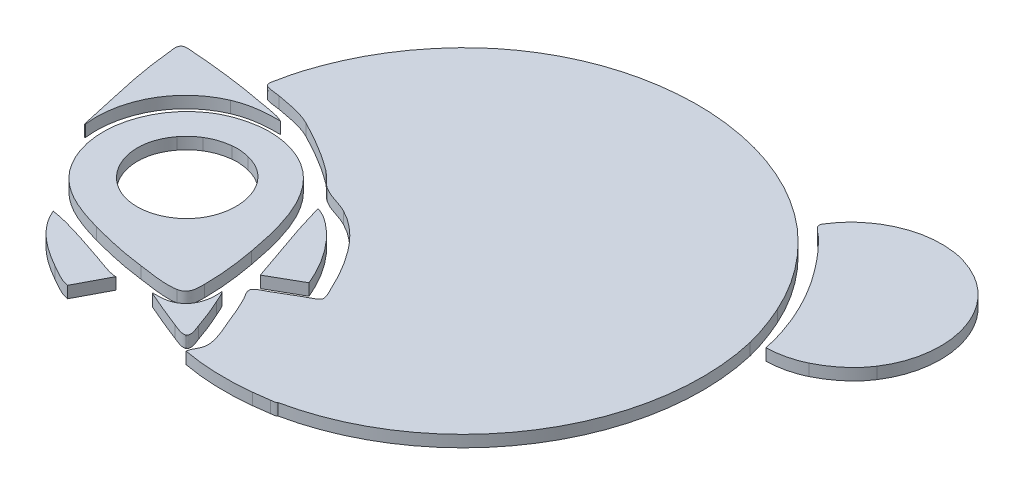
from build123d import *

# Parameters (mm, degrees)
SALIENTE_EXTRUIR1_DEPTH    = 0.3
SALIENTE_EXTRUIR1_2_DEPTH  = 0.3
SALIENTE_EXTRUIR1_3_DEPTH  = 0.3
SALIENTE_EXTRUIR1_4_DEPTH  = 0.3
SALIENTE_EXTRUIR1_5_DEPTH  = 0.3
SALIENTE_EXTRUIR1_6_DEPTH  = 0.3
SALIENTE_EXTRUIR1_7_DEPTH  = 0.3
SALIENTE_EXTRUIR1_8_DEPTH  = 0.3
SALIENTE_EXTRUIR1_9_DEPTH  = 0.3
SALIENTE_EXTRUIR1_10_DEPTH = 0.3
SALIENTE_EXTRUIR1_11_DEPTH = 0.3
SALIENTE_EXTRUIR1_12_DEPTH = 0.3
SALIENTE_EXTRUIR1_13_DEPTH = 0.3
SALIENTE_EXTRUIR1_14_DEPTH = 0.3
SALIENTE_EXTRUIR1_15_DEPTH = 0.3
SALIENTE_EXTRUIR1_16_DEPTH = 0.3
SALIENTE_EXTRUIR1_17_DEPTH = 0.3
SALIENTE_EXTRUIR1_18_DEPTH = 0.3
CROQUIS3_W                 = 32.379620454
CROQUIS3_H                 = 8.703750059
CORTAR_EXTRUIR2_DEPTH      = 10
SALIENTE_EXTRUIR2_DEPTH    = 0.3


with BuildPart() as part:
    # Croquis1 → Saliente-Extruir1 (new body)
    with BuildSketch(Plane(origin=(0, 0, 0), x_dir=(1, 0, 0), z_dir=(0, 1, 0))):
        with BuildLine():
            Line((3.578406282, 3.929124777), (1.831381085, 3.929124777))
            add(Edge.make_bspline(
                [(1.831381085, 3.929124777), (2.195955538, 4.293699449), (2.561850832, 4.656953063), (2.925104228, 5.022805122)],
                knots=[0, 0, 0, 0, 1, 1, 1, 1], degree=3))
            add(Edge.make_bspline(
                [(2.925104228, 5.022805122), (3.050477873, 5.149089533), (3.225876383, 5.406839742), (3.393761239, 5.468737315)],
                knots=[0, 0, 0, 0, 1, 1, 1, 1], degree=3))
            add(Edge.make_bspline(
                [(3.393761239, 5.468737315), (3.539659104, 5.52252512), (3.778106582, 5.477296898), (3.933492482, 5.477296898)],
                knots=[0, 0, 0, 0, 1, 1, 1, 1], degree=3))
            Line((3.933492482, 5.477296898), (5.154989666, 5.477296898))
            Line((5.154989666, 5.477296898), (5.154989666, 2.480368276))
            Line((5.154989666, 2.480368276), (5.169193769, 2.480368276))
            add(Edge.make_bspline(
                [(5.169193769, 2.480368276), (5.184873963, 2.677469913), (5.263674964, 2.886373947), (5.350372835, 3.062709863)],
                knots=[0, 0, 0, 0, 1, 1, 1, 1], degree=3))
            add(Edge.make_bspline(
                [(5.350372835, 3.062709863), (5.429102652, 3.222826461), (5.527291326, 3.374887662), (5.652324117, 3.503017188)],
                knots=[0, 0, 0, 0, 1, 1, 1, 1], degree=3))
            add(Edge.make_bspline(
                [(5.652324117, 3.503017188), (6.163520725, 4.026898354), (6.976569044, 4.092033938), (7.66900171, 4.026131922)],
                knots=[0, 0, 0, 0, 1, 1, 1, 1], degree=3))
            add(Edge.make_bspline(
                [(7.66900171, 4.026131922), (7.927561368, 4.001529673), (8.175738383, 3.943324513), (8.435988121, 3.943324513)],
                knots=[0, 0, 0, 0, 1, 1, 1, 1], degree=3))
            add(Edge.make_bspline(
                [(8.435988121, 3.943324513), (8.421102745, 4.664846657), (8.194841973, 5.406920534), (7.900603268, 6.059638484)],
                knots=[0, 0, 0, 0, 1, 1, 1, 1], degree=3))
            add(Edge.make_bspline(
                [(7.900603268, 6.059638484), (7.603907177, 6.717756614), (7.184706429, 7.310922142), (6.674759913, 7.820867784)],
                knots=[0, 0, 0, 0, 1, 1, 1, 1], degree=3))
            add(Edge.make_bspline(
                [(6.674759913, 7.820867784), (4.340535784, 10.155095188), (0.329636401, 10.188178411), (-1.988793551, 7.792404989)],
                knots=[0, 0, 0, 0, 1, 1, 1, 1], degree=3))
            add(Edge.make_bspline(
                [(-1.988793551, 7.792404989), (-2.582355833, 7.179041248), (-3.048016117, 6.446839277), (-3.346856689, 5.647739365)],
                knots=[0, 0, 0, 0, 1, 1, 1, 1], degree=3))
            add(Edge.make_bspline(
                [(-3.346856689, 5.647739365), (-3.449590458, 5.373001005), (-3.543901117, 5.085311909), (-3.59318728, 4.79553314)],
                knots=[0, 0, 0, 0, 1, 1, 1, 1], degree=3))
            add(Edge.make_bspline(
                [(-3.59318728, 4.79553314), (-3.604421732, 4.72948679), (-3.66630664, 4.565535848), (-3.622290079, 4.507599266)],
                knots=[0, 0, 0, 0, 1, 1, 1, 1], degree=3))
            add(Edge.make_bspline(
                [(-3.622290079, 4.507599266), (-3.566200576, 4.433755617), (-3.326460645, 4.433897549), (-3.239251383, 4.417564468)],
                knots=[0, 0, 0, 0, 1, 1, 1, 1], degree=3))
            add(Edge.make_bspline(
                [(-3.239251383, 4.417564468), (-2.921363774, 4.357994578), (-2.57941566, 4.304986306), (-2.28761993, 4.159089096)],
                knots=[0, 0, 0, 0, 1, 1, 1, 1], degree=3))
            add(Edge.make_bspline(
                [(-2.28761993, 4.159089096), (-1.838094895, 3.934334767), (-1.38344219, 3.663913319), (-0.980902058, 3.362474084)],
                knots=[0, 0, 0, 0, 1, 1, 1, 1], degree=3))
            add(Edge.make_bspline(
                [(-0.980902058, 3.362474084), (-0.821809334, 3.243336705), (-0.708252716, 3.076018703), (-0.540594951, 2.969478104)],
                knots=[0, 0, 0, 0, 1, 1, 1, 1], degree=3))
            add(Edge.make_bspline(
                [(-0.540594951, 2.969478104), (-0.333579702, 2.837927147), (-0.07820172, 2.799577161), (0.141170772, 2.689898776)],
                knots=[0, 0, 0, 0, 1, 1, 1, 1], degree=3))
            add(Edge.make_bspline(
                [(0.141170772, 2.689898776), (0.511298691, 2.504826409), (0.835989639, 2.197777591), (1.084322779, 1.869620448)],
                knots=[0, 0, 0, 0, 1, 1, 1, 1], degree=3))
            add(Edge.make_bspline(
                [(1.084322779, 1.869620448), (1.33001424, 1.544943912), (1.540693951, 1.189459429), (1.707897098, 0.81856333)],
                knots=[0, 0, 0, 0, 1, 1, 1, 1], degree=3))
            add(Edge.make_bspline(
                [(1.707897098, 0.81856333), (1.743135938, 0.740374165), (1.885795355, 0.518871167), (1.824251739, 0.44045491)],
                knots=[0, 0, 0, 0, 1, 1, 1, 1], degree=3))
            add(Edge.make_bspline(
                [(1.824251739, 0.44045491), (1.764753469, 0.3646502), (1.629991141, 0.314227271), (1.54731278, 0.266761111)],
                knots=[0, 0, 0, 0, 1, 1, 1, 1], degree=3))
            add(Edge.make_bspline(
                [(1.54731278, 0.266761111), (1.356759223, 0.157364406), (1.168165855, 0.044375734), (0.979174641, -0.06768929)],
                knots=[0, 0, 0, 0, 1, 1, 1, 1], degree=3))
            add(Edge.make_bspline(
                [(0.979174641, -0.06768929), (0.905629267, -0.111292938), (0.712476174, -0.17778015), (0.702647503, -0.275315719)],
                knots=[0, 0, 0, 0, 1, 1, 1, 1], degree=3))
            add(Edge.make_bspline(
                [(0.702647503, -0.275315719), (0.693756018, -0.363531824), (0.792825324, -0.48487264), (0.832751191, -0.559170471)],
                knots=[0, 0, 0, 0, 1, 1, 1, 1], degree=3))
            add(Edge.make_bspline(
                [(0.832751191, -0.559170471), (0.941933251, -0.762395048), (1.029199287, -0.984238683), (1.114831795, -1.198326505)],
                knots=[0, 0, 0, 0, 1, 1, 1, 1], degree=3))
            add(Edge.make_bspline(
                [(1.114831795, -1.198326505), (1.212949285, -1.443619465), (1.394554802, -1.782002251), (1.387396196, -2.050532731)],
                knots=[0, 0, 0, 0, 1, 1, 1, 1], degree=3))
            add(Edge.make_bspline(
                [(1.387396196, -2.050532731), (1.383277989, -2.204755882), (1.259564946, -2.307446852), (1.249039498, -2.448225563)],
                knots=[0, 0, 0, 0, 1, 1, 1, 1], degree=3))
            add(Edge.make_bspline(
                [(1.249039498, -2.448225563), (1.825884173, -2.555320788), (2.428281167, -2.569708311), (3.010267706, -2.507398044)],
                knots=[0, 0, 0, 0, 1, 1, 1, 1], degree=3))
            add(Edge.make_bspline(
                [(3.010267706, -2.507398044), (3.148538372, -2.49259346), (3.284877454, -2.477129439), (3.422167917, -2.454105909)],
                knots=[0, 0, 0, 0, 1, 1, 1, 1], degree=3))
            add(Edge.make_bspline(
                [(3.422167917, -2.454105909), (3.463372044, -2.447184002), (3.535980231, -2.44794825), (3.563804769, -2.411454295)],
                knots=[0, 0, 0, 0, 1, 1, 1, 1], degree=3))
            add(Edge.make_bspline(
                [(3.563804769, -2.411454295), (3.6257744, -2.330182151), (3.578406282, -2.066466219), (3.578406282, -1.965308331)],
                knots=[0, 0, 0, 0, 1, 1, 1, 1], degree=3))
            add(Edge.make_bspline(
                [(3.578406282, -1.965308331), (3.578406282, -1.558223977), (3.582638034, -1.150556611), (3.578463054, -0.74381071)],
                knots=[0, 0, 0, 0, 1, 1, 1, 1], degree=3))
            add(Edge.make_bspline(
                [(3.578463054, -0.74381071), (3.562442224, 0.813455967), (3.578406282, 2.371759839), (3.578406282, 3.929124777)],
                knots=[0, 0, 0, 0, 1, 1, 1, 1], degree=3))
        make_face()
    extrude(amount=SALIENTE_EXTRUIR1_DEPTH)


with BuildPart() as body_2:
    # Croquis1 → Saliente-Extruir1 2 (new body)
    with BuildSketch(Plane(origin=(0, 0, 0), x_dir=(1, 0, 0), z_dir=(0, 1, 0))):
        with BuildLine():
            Line((3.038675476, 4.426241963), (4.075527835, 4.426241963))
            Line((4.075527835, 4.426241963), (4.075527835, -0.829037512))
            Line((4.075527835, -0.829037512), (4.075527835, -2.078940937))
            add(Edge.make_bspline(
                [(4.075527835, -2.078940937), (4.075527835, -2.159346423), (4.032391907, -2.438244478), (4.098295888, -2.490442647)],
                knots=[0, 0, 0, 0, 1, 1, 1, 1], degree=3))
            add(Edge.make_bspline(
                [(4.098295888, -2.490442647), (4.135480505, -2.519901148), (4.215829437, -2.50505071), (4.260172659, -2.50505071)],
                knots=[0, 0, 0, 0, 1, 1, 1, 1], degree=3))
            Line((4.260172659, -2.50505071), (4.657869422, -2.50505071))
            Line((4.657869422, -2.50505071), (4.657869422, 4.980170977))
            Line((4.657869422, 4.980170977), (3.919289689, 4.980170977))
            Line((3.919289689, 4.980170977), (3.592610385, 4.971611394))
            Line((3.592610385, 4.971611394), (3.407965342, 4.809735059))
            Line((3.407965342, 4.809735059), (3.038675476, 4.426241963))
        make_face()
    extrude(amount=SALIENTE_EXTRUIR1_2_DEPTH)


with BuildPart() as body_3:
    # Croquis1 → Saliente-Extruir1 3 (new body)
    with BuildSketch(Plane(origin=(0, 0, 0), x_dir=(1, 0, 0), z_dir=(0, 1, 0))):
        with BuildLine():
            Line((18.63406794, 4.809735059), (18.63406794, 0.733343079))
            add(Edge.make_bspline(
                [(18.63406794, 0.733343079), (18.63406794, 0.008298841), (18.545581291, -0.783842043), (18.690882169, -1.49659935)],
                knots=[0, 0, 0, 0, 1, 1, 1, 1], degree=3))
            add(Edge.make_bspline(
                [(18.690882169, -1.49659935), (18.793005412, -1.996943849), (19.118832688, -2.395706629), (19.642512967, -2.474734066)],
                knots=[0, 0, 0, 0, 1, 1, 1, 1], degree=3))
            add(Edge.make_bspline(
                [(19.642512967, -2.474734066), (19.723756943, -2.486983876), (20.010524574, -2.555111166), (20.068190393, -2.482267372)],
                knots=[0, 0, 0, 0, 1, 1, 1, 1], degree=3))
            add(Edge.make_bspline(
                [(20.068190393, -2.482267372), (20.095744825, -2.44748315), (20.082820292, -2.375925696), (20.082820292, -2.33459514)],
                knots=[0, 0, 0, 0, 1, 1, 1, 1], degree=3))
            Line((20.082820292, -2.33459514), (20.082820292, -1.936897941))
            add(Edge.make_bspline(
                [(20.082820292, -1.936897941), (19.934820307, -1.936897941), (19.784263365, -1.944016369), (19.642512967, -1.893008245)],
                knots=[0, 0, 0, 0, 1, 1, 1, 1], degree=3))
            add(Edge.make_bspline(
                [(19.642512967, -1.893008245), (19.174367347, -1.724498016), (19.216409745, -1.115468873), (19.216409745, -0.71540032)],
                knots=[0, 0, 0, 0, 1, 1, 1, 1], degree=3))
            Line((19.216409745, -0.71540032), (19.216409745, 2.878074209))
            Line((19.216409745, 2.878074209), (20.082820292, 2.878074209))
            Line((20.082820292, 2.878074209), (20.082820292, 3.275771409))
            Line((20.082820292, 3.275771409), (20.068190393, 3.42344364))
            Line((20.068190393, 3.42344364), (19.855565561, 3.446211693))
            Line((19.855565561, 3.446211693), (19.216409745, 3.446211693))
            Line((19.216409745, 3.446211693), (19.216409745, 4.809743794))
            Line((19.216409745, 4.809743794), (18.63406794, 4.809735059))
        make_face()
    extrude(amount=SALIENTE_EXTRUIR1_3_DEPTH)


with BuildPart() as body_4:
    # Croquis1 → Saliente-Extruir1 4 (new body)
    with BuildSketch(Plane(origin=(0, 0, 0), x_dir=(1, 0, 0), z_dir=(0, 1, 0))):
        with BuildLine():
            Line((23.889347415, 4.809743794), (23.889347415, 0.804370145))
            add(Edge.make_bspline(
                [(23.889347415, 0.804370145), (23.889347415, 0.086455253), (23.82088604, -0.67162417), (23.921871645, -1.382962158)],
                knots=[0, 0, 0, 0, 1, 1, 1, 1], degree=3))
            add(Edge.make_bspline(
                [(23.921871645, -1.382962158), (23.977408269, -1.775148035), (24.15892819, -2.172987166), (24.528501047, -2.357745317)],
                knots=[0, 0, 0, 0, 1, 1, 1, 1], degree=3))
            add(Edge.make_bspline(
                [(24.528501047, -2.357745317), (24.773512327, -2.480265041), (25.054172739, -2.505035425), (25.323895446, -2.505035425)],
                knots=[0, 0, 0, 0, 1, 1, 1, 1], degree=3))
            Line((25.323895446, -2.505035425), (25.323895446, -1.936897941))
            add(Edge.make_bspline(
                [(25.323895446, -1.936897941), (25.180439464, -1.936897941), (25.035138586, -1.942444201), (24.897792224, -1.893008245)],
                knots=[0, 0, 0, 0, 1, 1, 1, 1], degree=3))
            add(Edge.make_bspline(
                [(24.897792224, -1.893008245), (24.430356263, -1.724753493), (24.471689002, -1.129629305), (24.471689002, -0.729604423)],
                knots=[0, 0, 0, 0, 1, 1, 1, 1], degree=3))
            Line((24.471689002, -0.729604423), (24.471689002, 2.878074209))
            Line((24.471689002, 2.878074209), (25.323895446, 2.878074209))
            Line((25.323895446, 2.878074209), (25.323895446, 3.446211693))
            Line((25.323895446, 3.446211693), (24.471689002, 3.446211693))
            Line((24.471689002, 3.446211693), (24.471689002, 4.809743794))
            Line((24.471689002, 4.809743794), (23.889347415, 4.809743794))
        make_face()
    extrude(amount=SALIENTE_EXTRUIR1_4_DEPTH)


with BuildPart() as body_5:
    # Croquis1 → Saliente-Extruir1 5 (new body)
    with BuildSketch(Plane(origin=(0, 0, 0), x_dir=(1, 0, 0), z_dir=(0, 1, 0))):
        with BuildLine():
            Line((-5.099902854, 1.301487332), (-5.085700498, 1.301487332))
            add(Edge.make_bspline(
                [(-5.085700498, 1.301487332), (-5.211824417, 2.29946412), (-4.694224936, 3.292242054), (-3.750575948, 3.695806498)],
                knots=[0, 0, 0, 0, 1, 1, 1, 1], degree=3))
            add(Edge.make_bspline(
                [(-3.750575948, 3.695806498), (-3.393032361, 3.848706189), (-3.039678822, 3.872312731), (-2.656910015, 3.872312731)],
                knots=[0, 0, 0, 0, 1, 1, 1, 1], degree=3))
            add(Edge.make_bspline(
                [(-2.656910015, 3.872312731), (-2.840816138, 3.970813437), (-3.106577199, 3.987814689), (-3.310268841, 4.028549131)],
                knots=[0, 0, 0, 0, 1, 1, 1, 1], degree=3))
            add(Edge.make_bspline(
                [(-3.310268841, 4.028549131), (-3.835541159, 4.133585034), (-4.368431941, 4.201845521), (-4.901055892, 4.253390803)],
                knots=[0, 0, 0, 0, 1, 1, 1, 1], degree=3))
            add(Edge.make_bspline(
                [(-4.901055892, 4.253390803), (-5.071193097, 4.269854897), (-5.242778007, 4.274418552), (-5.412380238, 4.29436762)],
                knots=[0, 0, 0, 0, 1, 1, 1, 1], degree=3))
            add(Edge.make_bspline(
                [(-5.412380238, 4.29436762), (-5.478458687, 4.302141119), (-5.569636801, 4.304346521), (-5.608685965, 4.238562199)],
                knots=[0, 0, 0, 0, 1, 1, 1, 1], degree=3))
            add(Edge.make_bspline(
                [(-5.608685965, 4.238562199), (-5.647504108, 4.173168736), (-5.621132297, 4.070648302), (-5.613583706, 4.000143108)],
                knots=[0, 0, 0, 0, 1, 1, 1, 1], degree=3))
            add(Edge.make_bspline(
                [(-5.613583706, 4.000143108), (-5.593783121, 3.815199354), (-5.573445815, 3.630312591), (-5.546194026, 3.446207326)],
                knots=[0, 0, 0, 0, 1, 1, 1, 1], degree=3))
            add(Edge.make_bspline(
                [(-5.546194026, 3.446207326), (-5.438327346, 2.717470676), (-5.248563586, 2.019812734), (-5.099902854, 1.301487332)],
                knots=[0, 0, 0, 0, 1, 1, 1, 1], degree=3))
        make_face()
    extrude(amount=SALIENTE_EXTRUIR1_5_DEPTH)


with BuildPart() as body_6:
    # Croquis1 → Saliente-Extruir1 6 (new body)
    with BuildSketch(Plane(origin=(0, 0, 0), x_dir=(1, 0, 0), z_dir=(0, 1, 0))):
        with BuildLine():
            Line((5.595298301, -2.505039792), (6.16343644, -2.505039792))
            add(Edge.make_bspline(
                [(6.16343644, -2.505039792), (6.16343644, -1.089766107), (6.146662278, 0.326632115), (6.163493212, 1.741792473)],
                knots=[0, 0, 0, 0, 1, 1, 1, 1], degree=3))
            add(Edge.make_bspline(
                [(6.163493212, 1.741792473), (6.16898925, 2.204612155), (6.291054574, 2.919302137), (6.873609058, 2.962012489)],
                knots=[0, 0, 0, 0, 1, 1, 1, 1], degree=3))
            add(Edge.make_bspline(
                [(6.873609058, 2.962012489), (7.500237313, 3.007946003), (7.726938511, 2.380834743), (7.739806707, 1.855420712)],
                knots=[0, 0, 0, 0, 1, 1, 1, 1], degree=3))
            add(Edge.make_bspline(
                [(7.739806707, 1.855420712), (7.775372209, 0.403899816), (7.740019824, -1.053034143), (7.740019824, -2.505039792)],
                knots=[0, 0, 0, 0, 1, 1, 1, 1], degree=3))
            Line((7.740019824, -2.505039792), (8.308157962, -2.505039792))
            Line((8.308157962, -2.505039792), (8.308157962, 1.585556074))
            add(Edge.make_bspline(
                [(8.308157962, 1.585556074), (8.308157962, 2.198775481), (8.285290557, 2.929117271), (7.725816376, 3.317822541)],
                knots=[0, 0, 0, 0, 1, 1, 1, 1], degree=3))
            add(Edge.make_bspline(
                [(7.725816376, 3.317822541), (6.987364599, 3.830866447), (5.919236355, 3.435754591), (5.693074717, 2.579796779)],
                knots=[0, 0, 0, 0, 1, 1, 1, 1], degree=3))
            add(Edge.make_bspline(
                [(5.693074717, 2.579796779), (5.531340096, 1.967656054), (5.595298301, 1.304312867), (5.595298301, 0.676533217)],
                knots=[0, 0, 0, 0, 1, 1, 1, 1], degree=3))
            Line((5.595298301, 0.676533217), (5.595298301, -2.505039792))
        make_face()
    extrude(amount=SALIENTE_EXTRUIR1_6_DEPTH)


with BuildPart() as body_7:
    # Croquis1 → Saliente-Extruir1 7 (new body)
    with BuildSketch(Plane(origin=(0, 0, 0), x_dir=(1, 0, 0), z_dir=(0, 1, 0))):
        with BuildLine():
            Line((12.824857486, 0.026684474), (13.946930752, 0.587804192))
            add(Edge.make_bspline(
                [(13.946930752, 0.587804192), (14.084702691, 0.656719531), (14.333548533, 0.726146042), (14.435529626, 0.841820502)],
                knots=[0, 0, 0, 0, 1, 1, 1, 1], degree=3))
            add(Edge.make_bspline(
                [(14.435529626, 0.841820502), (14.511517756, 0.92800589), (14.458254007, 1.23161974), (14.458254007, 1.344097457)],
                knots=[0, 0, 0, 0, 1, 1, 1, 1], degree=3))
            add(Edge.make_bspline(
                [(14.458254007, 1.344097457), (14.458254007, 1.85390095), (14.475875392, 2.394938402), (14.24136707, 2.863865739)],
                knots=[0, 0, 0, 0, 1, 1, 1, 1], degree=3))
            add(Edge.make_bspline(
                [(14.24136707, 2.863865739), (13.81668535, 3.713218043), (12.481275627, 3.769278941), (11.993244699, 2.949087956)],
                knots=[0, 0, 0, 0, 1, 1, 1, 1], degree=3))
            add(Edge.make_bspline(
                [(11.993244699, 2.949087956), (11.716845518, 2.484464647), (11.731191116, 1.922006403), (11.731191116, 1.400909503)],
                knots=[0, 0, 0, 0, 1, 1, 1, 1], degree=3))
            Line((11.731191116, 1.400909503), (11.731191116, -0.317707488))
            add(Edge.make_bspline(
                [(11.731191116, -0.317707488), (11.731191116, -0.761381873), (11.713720397, -1.207525873), (11.836722689, -1.638629463)],
                knots=[0, 0, 0, 0, 1, 1, 1, 1], degree=3))
            add(Edge.make_bspline(
                [(11.836722689, -1.638629463), (12.044377286, -2.366612783), (12.738927575, -2.726073541), (13.464013302, -2.549099806)],
                knots=[0, 0, 0, 0, 1, 1, 1, 1], degree=3))
            add(Edge.make_bspline(
                [(13.464013302, -2.549099806), (14.070642704, -2.40101488), (14.362950262, -1.832578029), (14.432121078, -1.255136367)],
                knots=[0, 0, 0, 0, 1, 1, 1, 1], degree=3))
            add(Edge.make_bspline(
                [(14.432121078, -1.255136367), (14.44718769, -1.128341001), (14.458254007, -0.999445043), (14.458254007, -0.871643271)],
                knots=[0, 0, 0, 0, 1, 1, 1, 1], degree=3))
            add(Edge.make_bspline(
                [(14.458254007, -0.871643271), (14.458254007, -0.83447241), (14.468909814, -0.770670767), (14.435529626, -0.744208119)],
                knots=[0, 0, 0, 0, 1, 1, 1, 1], degree=3))
            add(Edge.make_bspline(
                [(14.435529626, -0.744208119), (14.398315312, -0.714751801), (14.317925111, -0.729600056), (14.27360962, -0.729600056)],
                knots=[0, 0, 0, 0, 1, 1, 1, 1], degree=3))
            Line((14.27360962, -0.729600056), (13.87591242, -0.729608791))
            add(Edge.make_bspline(
                [(13.87591242, -0.729608791), (13.87591242, -1.065532881), (13.873641511, -1.416089053), (13.683457196, -1.709645393)],
                knots=[0, 0, 0, 0, 1, 1, 1, 1], degree=3))
            add(Edge.make_bspline(
                [(13.683457196, -1.709645393), (13.441712532, -2.082814585), (12.907804426, -2.152679993), (12.598880141, -1.823217078)],
                knots=[0, 0, 0, 0, 1, 1, 1, 1], degree=3))
            add(Edge.make_bspline(
                [(12.598880141, -1.823217078), (12.443637483, -1.657619727), (12.374322333, -1.432210328), (12.338387372, -1.212526241)],
                knots=[0, 0, 0, 0, 1, 1, 1, 1], degree=3))
            add(Edge.make_bspline(
                [(12.338387372, -1.212526241), (12.300181501, -0.978480617), (12.313531829, -0.738755753), (12.313531829, -0.502351876)],
                knots=[0, 0, 0, 0, 1, 1, 1, 1], degree=3))
            add(Edge.make_bspline(
                [(12.313531829, -0.502351876), (12.313531829, -0.431023696), (12.288534355, -0.300110122), (12.328161728, -0.238026946)],
                knots=[0, 0, 0, 0, 1, 1, 1, 1], degree=3))
            add(Edge.make_bspline(
                [(12.328161728, -0.238026946), (12.403724063, -0.119511666), (12.699725998, -0.03591184), (12.824857486, 0.026684474)],
                knots=[0, 0, 0, 0, 1, 1, 1, 1], degree=3))
        make_face()
        with BuildLine():
            add(Edge.make_bspline(
                [(12.313529646, 0.435074601), (12.313529646, 0.940078832), (12.291934168, 1.450367076), (12.314184716, 1.954845067)],
                knots=[0, 0, 0, 0, 1, 1, 1, 1], degree=3))
            add(Edge.make_bspline(
                [(12.314184716, 1.954845067), (12.321718022, 2.127801038), (12.3607733, 2.30332685), (12.417871393, 2.466170723)],
                knots=[0, 0, 0, 0, 1, 1, 1, 1], degree=3))
            add(Edge.make_bspline(
                [(12.417871393, 2.466170723), (12.593851387, 2.967637357), (13.24848891, 3.155605352), (13.617780087, 2.736035362)],
                knots=[0, 0, 0, 0, 1, 1, 1, 1], degree=3))
            add(Edge.make_bspline(
                [(13.617780087, 2.736035362), (13.862363387, 2.458102444), (13.875997579, 2.03466754), (13.875997579, 1.684980428)],
                knots=[0, 0, 0, 0, 1, 1, 1, 1], degree=3))
            add(Edge.make_bspline(
                [(13.875997579, 1.684980428), (13.875997579, 1.573354301), (13.925710848, 1.303332446), (13.861367681, 1.211109495)],
                knots=[0, 0, 0, 0, 1, 1, 1, 1], degree=3))
            add(Edge.make_bspline(
                [(13.861367681, 1.211109495), (13.79219883, 1.111984289), (13.557415378, 1.046306962), (13.449894358, 0.992519376)],
                knots=[0, 0, 0, 0, 1, 1, 1, 1], degree=3))
            add(Edge.make_bspline(
                [(13.449894358, 0.992519376), (13.088699847, 0.81192092), (12.701230475, 0.546742216), (12.313529646, 0.435074601)],
                knots=[0, 0, 0, 0, 1, 1, 1, 1], degree=3))
        make_face(mode=Mode.SUBTRACT)
    extrude(amount=SALIENTE_EXTRUIR1_7_DEPTH)


with BuildPart() as body_8:
    # Croquis1 → Saliente-Extruir1 8 (new body)
    with BuildSketch(Plane(origin=(0, 0, 0), x_dir=(1, 0, 0), z_dir=(0, 1, 0))):
        with BuildLine():
            Line((17.298946448, -2.505031057), (17.725049669, -2.505031057))
            add(Edge.make_bspline(
                [(17.725049669, -2.505031057), (17.768227523, -2.505031057), (17.849329567, -2.519748299), (17.872765572, -2.472107235)],
                knots=[0, 0, 0, 0, 1, 1, 1, 1], degree=3))
            add(Edge.make_bspline(
                [(17.872765572, -2.472107235), (17.91906811, -2.377853785), (17.881281484, -2.183507592), (17.881281484, -2.078927836)],
                knots=[0, 0, 0, 0, 1, 1, 1, 1], degree=3))
            Line((17.881281484, -2.078927836), (17.881281484, -1.098889049))
            add(Edge.make_bspline(
                [(17.881281484, -1.098889049), (17.881281484, -0.073244284), (17.912528327, 0.959377196), (17.86763419, 1.983259824)],
                knots=[0, 0, 0, 0, 1, 1, 1, 1], degree=3))
            add(Edge.make_bspline(
                [(17.86763419, 1.983259824), (17.846038931, 2.477158432), (17.716793603, 3.045125598), (17.270520773, 3.331310216)],
                knots=[0, 0, 0, 0, 1, 1, 1, 1], degree=3))
            add(Edge.make_bspline(
                [(17.270520773, 3.331310216), (16.580090438, 3.774089339), (15.593376269, 3.492946577), (15.3023485, 2.721839993)],
                knots=[0, 0, 0, 0, 1, 1, 1, 1], degree=3))
            add(Edge.make_bspline(
                [(15.3023485, 2.721839993), (15.128355552, 2.261109767), (15.154206801, 1.756686583), (15.154206801, 1.27308786)],
                knots=[0, 0, 0, 0, 1, 1, 1, 1], degree=3))
            Line((15.154206801, 1.27308786), (15.154206801, -0.786412101))
            Line((15.154206801, -0.786412101), (15.154206801, -2.064723732))
            add(Edge.make_bspline(
                [(15.154206801, -2.064723732), (15.154206801, -2.147118448), (15.109749378, -2.43716798), (15.176931182, -2.490429545)],
                knots=[0, 0, 0, 0, 1, 1, 1, 1], degree=3))
            add(Edge.make_bspline(
                [(15.176931182, -2.490429545), (15.227353892, -2.530299294), (15.362713208, -2.505037608), (15.42407144, -2.505037608)],
                knots=[0, 0, 0, 0, 1, 1, 1, 1], degree=3))
            add(Edge.make_bspline(
                [(15.42407144, -2.505037608), (15.49366827, -2.505037608), (15.657293641, -2.535205769), (15.713821823, -2.490429545)],
                knots=[0, 0, 0, 0, 1, 1, 1, 1], degree=3))
            add(Edge.make_bspline(
                [(15.713821823, -2.490429545), (15.762541569, -2.451824081), (15.736548388, -2.305302589), (15.736548388, -2.249368338)],
                knots=[0, 0, 0, 0, 1, 1, 1, 1], degree=3))
            Line((15.736548388, -2.249368338), (15.736548388, -1.524992271))
            Line((15.736548388, -1.524992271), (15.736548388, 1.102647357))
            add(Edge.make_bspline(
                [(15.736548388, 1.102647357), (15.736548388, 1.566063371), (15.671637493, 2.0888069), (15.868783019, 2.522991503)],
                knots=[0, 0, 0, 0, 1, 1, 1, 1], degree=3))
            add(Edge.make_bspline(
                [(15.868783019, 2.522991503), (16.106263177, 3.045907315), (16.803368676, 3.121753513), (17.113288667, 2.622415639)],
                knots=[0, 0, 0, 0, 1, 1, 1, 1], degree=3))
            add(Edge.make_bspline(
                [(17.113288667, 2.622415639), (17.372360152, 2.205118743), (17.298928979, 1.641156239), (17.298928979, 1.173663505)],
                knots=[0, 0, 0, 0, 1, 1, 1, 1], degree=3))
            Line((17.298928979, 1.173663505), (17.298928979, -0.303494652))
            Line((17.298928979, -0.303494652), (17.298946448, -2.505031057))
        make_face()
    extrude(amount=SALIENTE_EXTRUIR1_8_DEPTH)


with BuildPart() as body_9:
    # Croquis1 → Saliente-Extruir1 9 (new body)
    with BuildSketch(Plane(origin=(0, 0, 0), x_dir=(1, 0, 0), z_dir=(0, 1, 0))):
        with BuildLine():
            Line((20.452096184, 1.244681837), (20.452096184, -0.331902857))
            add(Edge.make_bspline(
                [(20.452096184, -0.331902857), (20.452096184, -0.752311336), (20.43860174, -1.171141097), (20.542569879, -1.5818065)],
                knots=[0, 0, 0, 0, 1, 1, 1, 1], degree=3))
            add(Edge.make_bspline(
                [(20.542569879, -1.5818065), (20.726646757, -2.30814341), (21.344355578, -2.675102537), (22.071288602, -2.571985771)],
                knots=[0, 0, 0, 0, 1, 1, 1, 1], degree=3))
            add(Edge.make_bspline(
                [(22.071288602, -2.571985771), (22.63204148, -2.492460262), (22.974201838, -2.048517298), (23.102885989, -1.524992271)],
                knots=[0, 0, 0, 0, 1, 1, 1, 1], degree=3))
            add(Edge.make_bspline(
                [(23.102885989, -1.524992271), (23.27588323, -0.820316346), (23.179157983, -0.01610252), (23.179157983, 0.704950158)],
                knots=[0, 0, 0, 0, 1, 1, 1, 1], degree=3))
            add(Edge.make_bspline(
                [(23.179157983, 0.704950158), (23.179157983, 1.338538096), (23.257135125, 2.040159211), (23.056013541, 2.650823845)],
                knots=[0, 0, 0, 0, 1, 1, 1, 1], degree=3))
            add(Edge.make_bspline(
                [(23.056013541, 2.650823845), (22.860147584, 3.245266978), (22.301242222, 3.608832842), (21.673591402, 3.525416217)],
                knots=[0, 0, 0, 0, 1, 1, 1, 1], degree=3))
            add(Edge.make_bspline(
                [(21.673591402, 3.525416217), (21.175618476, 3.459212651), (20.793263018, 3.220153775), (20.605633476, 2.736044096)],
                knots=[0, 0, 0, 0, 1, 1, 1, 1], degree=3))
            add(Edge.make_bspline(
                [(20.605633476, 2.736044096), (20.422410591, 2.262898108), (20.452096184, 1.742440992), (20.452096184, 1.244681837)],
                knots=[0, 0, 0, 0, 1, 1, 1, 1], degree=3))
        make_face()
        with BuildLine():
            add(Edge.make_bspline(
                [(21.702102236, 2.959184769), (22.193542149, 3.023187301), (22.478178618, 2.654577397), (22.561979551, 2.210507786)],
                knots=[0, 0, 0, 0, 1, 1, 1, 1], degree=3))
            add(Edge.make_bspline(
                [(22.561979551, 2.210507786), (22.659840471, 1.691328057), (22.596918806, 1.118290431), (22.596918806, 0.591313184)],
                knots=[0, 0, 0, 0, 1, 1, 1, 1], degree=3))
            add(Edge.make_bspline(
                [(22.596918806, 0.591313184), (22.596918806, 0.055503191), (22.660833994, -0.525419077), (22.590957668, -1.056287658)],
                knots=[0, 0, 0, 0, 1, 1, 1, 1], degree=3))
            add(Edge.make_bspline(
                [(22.590957668, -1.056287658), (22.535706873, -1.475899135), (22.411143331, -1.967764843), (21.915157232, -2.032221338)],
                knots=[0, 0, 0, 0, 1, 1, 1, 1], degree=3))
            add(Edge.make_bspline(
                [(21.915157232, -2.032221338), (21.432239781, -2.094972686), (21.150869928, -1.71544058), (21.06948402, -1.283542171)],
                knots=[0, 0, 0, 0, 1, 1, 1, 1], degree=3))
            add(Edge.make_bspline(
                [(21.06948402, -1.283542171), (20.974035941, -0.777559921), (21.034542582, -0.220484169), (21.034542582, 0.293040121)],
                knots=[0, 0, 0, 0, 1, 1, 1, 1], degree=3))
            add(Edge.make_bspline(
                [(21.034542582, 0.293040121), (21.034542582, 0.849362542), (20.97318435, 1.44532522), (21.038669523, 1.997455192)],
                knots=[0, 0, 0, 0, 1, 1, 1, 1], degree=3))
            add(Edge.make_bspline(
                [(21.038669523, 1.997455192), (21.086819358, 2.404428184), (21.22416572, 2.896918392), (21.702102236, 2.959184769)],
                knots=[0, 0, 0, 0, 1, 1, 1, 1], degree=3))
        make_face(mode=Mode.SUBTRACT)
    extrude(amount=SALIENTE_EXTRUIR1_9_DEPTH)


with BuildPart() as body_10:
    # Croquis1 → Saliente-Extruir1 10 (new body)
    with BuildSketch(Plane(origin=(0, 0, 0), x_dir=(1, 0, 0), z_dir=(0, 1, 0))):
        with BuildLine():
            Line((28.420233137, -0.729600056), (27.852095435, -0.729600056))
            add(Edge.make_bspline(
                [(27.852095435, -0.729600056), (27.852095435, -1.064928033), (27.846702025, -1.417615366), (27.657507084, -1.709636659)],
                knots=[0, 0, 0, 0, 1, 1, 1, 1], degree=3))
            add(Edge.make_bspline(
                [(27.657507084, -1.709636659), (27.395027268, -2.115033115), (26.823197155, -2.146352016), (26.524356582, -1.766450888)],
                knots=[0, 0, 0, 0, 1, 1, 1, 1], degree=3))
            add(Edge.make_bspline(
                [(26.524356582, -1.766450888), (26.218412867, -1.377546912), (26.28659016, -0.793698664), (26.289714844, -0.331902857)],
                knots=[0, 0, 0, 0, 1, 1, 1, 1], degree=3))
            add(Edge.make_bspline(
                [(26.289714844, -0.331902857), (26.291024984, -0.143052701), (26.637414911, -0.055007133), (26.786836398, 0.019675225)],
                knots=[0, 0, 0, 0, 1, 1, 1, 1], degree=3))
            Line((26.786836398, 0.019675225), (27.837891332, 0.545202801))
            add(Edge.make_bspline(
                [(27.837891332, 0.545202801), (28.013445748, 0.633008395), (28.211726512, 0.707563887), (28.37549185, 0.815678838)],
                knots=[0, 0, 0, 0, 1, 1, 1, 1], degree=3))
            add(Edge.make_bspline(
                [(28.37549185, 0.815678838), (28.43443724, 0.854596552), (28.420233137, 0.926750339), (28.420233137, 0.989019118)],
                knots=[0, 0, 0, 0, 1, 1, 1, 1], degree=3))
            Line((28.420233137, 0.989019118), (28.420233137, 1.457732247))
            add(Edge.make_bspline(
                [(28.420233137, 1.457732247), (28.420233137, 2.103777435), (28.433159853, 2.894269726), (27.837891332, 3.312136533)],
                knots=[0, 0, 0, 0, 1, 1, 1, 1], degree=3))
            add(Edge.make_bspline(
                [(27.837891332, 3.312136533), (27.405538741, 3.615649939), (26.700336576, 3.615280916), (26.275510741, 3.2968734)],
                knots=[0, 0, 0, 0, 1, 1, 1, 1], degree=3))
            add(Edge.make_bspline(
                [(26.275510741, 3.2968734), (26.063453854, 3.13789444), (25.926533288, 2.911760097), (25.838328319, 2.66501703)],
                knots=[0, 0, 0, 0, 1, 1, 1, 1], degree=3))
            add(Edge.make_bspline(
                [(25.838328319, 2.66501703), (25.682091919, 2.227893346), (25.707373257, 1.757843874), (25.707373257, 1.301487332)],
                knots=[0, 0, 0, 0, 1, 1, 1, 1], degree=3))
            Line((25.707373257, 1.301487332), (25.707373257, -0.644386356))
            add(Edge.make_bspline(
                [(25.707373257, -0.644386356), (25.707373257, -1.133994255), (25.726828839, -1.65746251), (26.010760016, -2.07893657)],
                knots=[0, 0, 0, 0, 1, 1, 1, 1], degree=3))
            add(Edge.make_bspline(
                [(26.010760016, -2.07893657), (26.442544879, -2.71989623), (27.526126227, -2.77463607), (28.032621834, -2.192562844)],
                knots=[0, 0, 0, 0, 1, 1, 1, 1], degree=3))
            add(Edge.make_bspline(
                [(28.032621834, -2.192562844), (28.385719678, -1.786786447), (28.430742645, -1.240733559), (28.420233137, -0.729600056)],
                knots=[0, 0, 0, 0, 1, 1, 1, 1], degree=3))
        make_face()
        with BuildLine():
            add(Edge.make_bspline(
                [(26.289828389, 0.435074601), (26.289828389, 0.949524942), (26.267955599, 1.469342273), (26.29048346, 1.983251089)],
                knots=[0, 0, 0, 0, 1, 1, 1, 1], degree=3))
            add(Edge.make_bspline(
                [(26.29048346, 1.983251089), (26.297732902, 2.147870202), (26.33394736, 2.327686723), (26.395731387, 2.480372643)],
                knots=[0, 0, 0, 0, 1, 1, 1, 1], degree=3))
            add(Edge.make_bspline(
                [(26.395731387, 2.480372643), (26.584780247, 2.947026669), (27.20973196, 3.166158531), (27.579872544, 2.750182693)],
                knots=[0, 0, 0, 0, 1, 1, 1, 1], degree=3))
            add(Edge.make_bspline(
                [(27.579872544, 2.750182693), (27.827724644, 2.471553216), (27.852296323, 2.052535669), (27.852296323, 1.699182347)],
                knots=[0, 0, 0, 0, 1, 1, 1, 1], degree=3))
            add(Edge.make_bspline(
                [(27.852296323, 1.699182347), (27.852296323, 1.584689197), (27.903712774, 1.305590254), (27.837666425, 1.211109495)],
                knots=[0, 0, 0, 0, 1, 1, 1, 1], degree=3))
            add(Edge.make_bspline(
                [(27.837666425, 1.211109495), (27.768495609, 1.111969004), (27.533711938, 1.046306962), (27.426193101, 0.992519376)],
                knots=[0, 0, 0, 0, 1, 1, 1, 1], degree=3))
            add(Edge.make_bspline(
                [(27.426193101, 0.992519376), (27.064998591, 0.81192092), (26.677527036, 0.546742216), (26.289828389, 0.435074601)],
                knots=[0, 0, 0, 0, 1, 1, 1, 1], degree=3))
        make_face(mode=Mode.SUBTRACT)
    extrude(amount=SALIENTE_EXTRUIR1_10_DEPTH)


with BuildPart() as body_11:
    # Croquis1 → Saliente-Extruir1 11 (new body)
    with BuildSketch(Plane(origin=(0, 0, 0), x_dir=(1, 0, 0), z_dir=(0, 1, 0))):
        with BuildLine():
            Line((31.687028581, -0.786420836), (31.118888914, -0.786420836))
            add(Edge.make_bspline(
                [(31.118888914, -0.786420836), (31.118888914, -1.098812625), (31.124719038, -1.452834118), (30.943334497, -1.723849496)],
                knots=[0, 0, 0, 0, 1, 1, 1, 1], degree=3))
            add(Edge.make_bspline(
                [(30.943334497, -1.723849496), (30.672190288, -2.129031963), (30.084166842, -2.117526749), (29.822115006, -1.709634475)],
                knots=[0, 0, 0, 0, 1, 1, 1, 1], degree=3))
            add(Edge.make_bspline(
                [(29.822115006, -1.709634475), (29.634911478, -1.418335943), (29.655932677, -1.01848138), (29.655932677, -0.686987747)],
                knots=[0, 0, 0, 0, 1, 1, 1, 1], degree=3))
            Line((29.655932677, -0.686987747), (29.655932677, 1.358310295))
            add(Edge.make_bspline(
                [(29.655932677, 1.358310295), (29.655932677, 1.729673676), (29.609914003, 2.157014981), (29.753369767, 2.508791767)],
                knots=[0, 0, 0, 0, 1, 1, 1, 1], degree=3))
            add(Edge.make_bspline(
                [(29.753369767, 2.508791767), (29.948665813, 2.987219586), (30.575890618, 3.142562906), (30.91251345, 2.707640257)],
                knots=[0, 0, 0, 0, 1, 1, 1, 1], degree=3))
            add(Edge.make_bspline(
                [(30.91251345, 2.707640257), (31.123860896, 2.434635649), (31.118888914, 2.05494851), (31.118888914, 1.727601471)],
                knots=[0, 0, 0, 0, 1, 1, 1, 1], degree=3))
            Line((31.118888914, 1.727601471), (31.687028581, 1.727601471))
            add(Edge.make_bspline(
                [(31.687028581, 1.727601471), (31.687028581, 2.224465146), (31.662882698, 2.7337448), (31.325692139, 3.133743479)],
                knots=[0, 0, 0, 0, 1, 1, 1, 1], degree=3))
            add(Edge.make_bspline(
                [(31.325692139, 3.133743479), (30.839082276, 3.711071596), (29.791575638, 3.656146371), (29.368313237, 3.034319125)],
                knots=[0, 0, 0, 0, 1, 1, 1, 1], degree=3))
            add(Edge.make_bspline(
                [(29.368313237, 3.034319125), (29.099584053, 2.639576292), (29.087794975, 2.158248696), (29.087794975, 1.699193265)],
                knots=[0, 0, 0, 0, 1, 1, 1, 1], degree=3))
            Line((29.087794975, 1.699193265), (29.087794975, -0.587563393))
            add(Edge.make_bspline(
                [(29.087794975, -0.587563393), (29.087794975, -1.091530429), (29.067203939, -1.621191497), (29.349707063, -2.064721549)],
                knots=[0, 0, 0, 0, 1, 1, 1, 1], degree=3))
            add(Edge.make_bspline(
                [(29.349707063, -2.064721549), (29.767145891, -2.720311108), (30.846325168, -2.779824225), (31.339610195, -2.178350006)],
                knots=[0, 0, 0, 0, 1, 1, 1, 1], degree=3))
            add(Edge.make_bspline(
                [(31.339610195, -2.178350006), (31.665721335, -1.780510875), (31.687028581, -1.275122337), (31.687028581, -0.786420836)],
                knots=[0, 0, 0, 0, 1, 1, 1, 1], degree=3))
        make_face()
    extrude(amount=SALIENTE_EXTRUIR1_11_DEPTH)


with BuildPart() as body_12:
    # Croquis1 → Saliente-Extruir1 12 (new body)
    with BuildSketch(Plane(origin=(0, 0, 0), x_dir=(1, 0, 0), z_dir=(0, 1, 0))):
        with BuildLine():
            Line((34.485108712, -2.235164235), (34.485108712, -2.505028874))
            Line((34.485108712, -2.505028874), (35.024840392, -2.505028874))
            Line((35.024840392, -2.505028874), (35.024840392, 0.065796526))
            Line((35.024840392, 0.065796526), (35.024840392, 1.869635733))
            add(Edge.make_bspline(
                [(35.024840392, 1.869635733), (35.024840392, 2.329472881), (34.925699901, 2.867427137), (34.582118042, 3.200698193)],
                knots=[0, 0, 0, 0, 1, 1, 1, 1], degree=3))
            add(Edge.make_bspline(
                [(34.582118042, 3.200698193), (34.039971337, 3.726467927), (32.973434913, 3.629314701), (32.576305441, 2.977504896)],
                knots=[0, 0, 0, 0, 1, 1, 1, 1], degree=3))
            add(Edge.make_bspline(
                [(32.576305441, 2.977504896), (32.308713896, 2.538162926), (32.311980512, 2.025048928), (32.311980512, 1.528752763)],
                knots=[0, 0, 0, 0, 1, 1, 1, 1], degree=3))
            Line((32.311980512, 1.528752763), (32.311980512, -0.402916822))
            add(Edge.make_bspline(
                [(32.311980512, -0.402916822), (32.311980512, -0.850525995), (32.284851876, -1.309622695), (32.44052033, -1.738042681)],
                knots=[0, 0, 0, 0, 1, 1, 1, 1], degree=3))
            add(Edge.make_bspline(
                [(32.44052033, -1.738042681), (32.528723333, -1.980567097), (32.670048154, -2.209013837), (32.880117995, -2.364073294)],
                knots=[0, 0, 0, 0, 1, 1, 1, 1], degree=3))
            add(Edge.make_bspline(
                [(32.880117995, -2.364073294), (33.361755876, -2.719487903), (34.070508521, -2.64949148), (34.485108712, -2.235164235)],
                knots=[0, 0, 0, 0, 1, 1, 1, 1], degree=3))
        make_face()
        with BuildLine():
            add(Edge.make_bspline(
                [(33.547880722, 2.959184769), (34.062189131, 3.026170053), (34.347677191, 2.631639026), (34.422246003, 2.167897879)],
                knots=[0, 0, 0, 0, 1, 1, 1, 1], degree=3))
            add(Edge.make_bspline(
                [(34.422246003, 2.167897879), (34.500365295, 1.682395085), (34.456901394, 1.167206698), (34.456901394, 0.676533217)],
                knots=[0, 0, 0, 0, 1, 1, 1, 1], degree=3))
            add(Edge.make_bspline(
                [(34.456901394, 0.676533217), (34.456901394, 0.08926332), (34.49596104, -0.514424817), (34.44028445, -1.098897784)],
                knots=[0, 0, 0, 0, 1, 1, 1, 1], degree=3))
            add(Edge.make_bspline(
                [(34.44028445, -1.098897784), (34.401366736, -1.507274809), (34.240300504, -1.971756404), (33.775135453, -2.032221338)],
                knots=[0, 0, 0, 0, 1, 1, 1, 1], degree=3))
            add(Edge.make_bspline(
                [(33.775135453, -2.032221338), (33.26182275, -2.098920575), (32.976760486, -1.686962499), (32.910572204, -1.226728161)],
                knots=[0, 0, 0, 0, 1, 1, 1, 1], degree=3))
            add(Edge.make_bspline(
                [(32.910572204, -1.226728161), (32.843106535, -0.757346642), (32.880318884, -0.265793184), (32.880318884, 0.207820088)],
                knots=[0, 0, 0, 0, 1, 1, 1, 1], degree=3))
            add(Edge.make_bspline(
                [(32.880318884, 0.207820088), (32.880318884, 0.816523879), (32.853048316, 1.433265379), (32.895800373, 2.040065318)],
                knots=[0, 0, 0, 0, 1, 1, 1, 1], degree=3))
            add(Edge.make_bspline(
                [(32.895800373, 2.040065318), (32.923354805, 2.431157227), (33.108995117, 2.902001736), (33.547880722, 2.959184769)],
                knots=[0, 0, 0, 0, 1, 1, 1, 1], degree=3))
        make_face(mode=Mode.SUBTRACT)
    extrude(amount=SALIENTE_EXTRUIR1_12_DEPTH)


with BuildPart() as body_13:
    # Croquis1 → Saliente-Extruir1 13 (new body)
    with BuildSketch(Plane(origin=(0, 0, 0), x_dir=(1, 0, 0), z_dir=(0, 1, 0))):
        with BuildLine():
            Line((8.663242852, 3.446207326), (8.770904713, 2.821255614))
            Line((8.770904713, 2.821255614), (9.049576769, 1.358299377))
            Line((9.049576769, 1.358299377), (9.785315682, -2.505039792))
            add(Edge.make_bspline(
                [(9.785315682, -2.505039792), (9.892409597, -2.505039792), (10.174348269, -2.555689811), (10.259852821, -2.490431729)],
                knots=[0, 0, 0, 0, 1, 1, 1, 1], degree=3))
            add(Edge.make_bspline(
                [(10.259852821, -2.490431729), (10.326609267, -2.439554619), (10.331722307, -2.215780711), (10.347772398, -2.135744248)],
                knots=[0, 0, 0, 0, 1, 1, 1, 1], degree=3))
            add(Edge.make_bspline(
                [(10.347772398, -2.135744248), (10.413818529, -1.804746285), (10.47702384, -1.472953504), (10.540939465, -1.141501359)],
                knots=[0, 0, 0, 0, 1, 1, 1, 1], degree=3))
            Line((10.540939465, -1.141501359), (11.131803077, 1.912241492))
            add(Edge.make_bspline(
                [(11.131803077, 1.912241492), (11.19401421, 2.234247526), (11.255941261, 2.556338938), (11.319288722, 2.878076393)],
                knots=[0, 0, 0, 0, 1, 1, 1, 1], degree=3))
            add(Edge.make_bspline(
                [(11.319288722, 2.878076393), (11.355791629, 3.063487212), (11.414735709, 3.256741623), (11.418712858, 3.446213877)],
                knots=[0, 0, 0, 0, 1, 1, 1, 1], degree=3))
            Line((11.418712858, 3.446213877), (10.850574719, 3.446213877))
            add(Edge.make_bspline(
                [(10.850574719, 3.446213877), (10.657975816, 2.453379388), (10.470206089, 1.458754157), (10.290674305, 0.463489358)],
                knots=[0, 0, 0, 0, 1, 1, 1, 1], degree=3))
            add(Edge.make_bspline(
                [(10.290674305, 0.463489358), (10.206163931, -0.004898638), (10.042256006, -0.508354501), (10.040977746, -0.985262776)],
                knots=[0, 0, 0, 0, 1, 1, 1, 1], degree=3))
            Line((10.040977746, -0.985262776), (10.026773643, -0.985262776))
            Line((10.026773643, -0.985262776), (9.245584221, 3.446207326))
            Line((9.245584221, 3.446207326), (8.663242852, 3.446207326))
        make_face()
    extrude(amount=SALIENTE_EXTRUIR1_13_DEPTH)


with BuildPart() as body_14:
    # Croquis1 → Saliente-Extruir1 14 (new body)
    with BuildSketch(Plane(origin=(0, 0, 0), x_dir=(1, 0, 0), z_dir=(0, 1, 0))):
        with BuildLine():
            Line((-0.227934584, 2.409356495), (-0.00540924, 1.684980428))
            Line((-0.00540924, 1.684980428), (0.510644931, 0.193615985))
            Line((0.510644931, 0.193615985), (1.306038457, 0.648127413))
            add(Edge.make_bspline(
                [(1.306038457, 0.648127413), (1.09710538, 1.14996307), (0.773423022, 1.66334783), (0.368610233, 2.028263139)],
                knots=[0, 0, 0, 0, 1, 1, 1, 1], degree=3))
            add(Edge.make_bspline(
                [(0.368610233, 2.028263139), (0.19622308, 2.183663014), (-0.000338561, 2.3438211), (-0.227934584, 2.409356495)],
                knots=[0, 0, 0, 0, 1, 1, 1, 1], degree=3))
        make_face()
    extrude(amount=SALIENTE_EXTRUIR1_14_DEPTH)


with BuildPart() as body_15:
    # Croquis1 → Saliente-Extruir1 15 (new body)
    with BuildSketch(Plane(origin=(0, 0, 0), x_dir=(1, 0, 0), z_dir=(0, 1, 0))):
        with BuildLine():
            Line((-0.469393636, -1.581815234), (-0.469393636, -1.596030255))
            add(Edge.make_bspline(
                [(-0.469393636, -1.596030255), (-0.137046666, -1.734400492), (0.185584742, -1.884302364), (0.524848379, -2.007162942)],
                knots=[0, 0, 0, 0, 1, 1, 1, 1], degree=3))
            add(Edge.make_bspline(
                [(0.524848379, -2.007162942), (0.605097959, -2.036223816), (0.809797972, -2.13507826), (0.889621538, -2.088079165)],
                knots=[0, 0, 0, 0, 1, 1, 1, 1], degree=3))
            add(Edge.make_bspline(
                [(0.889621538, -2.088079165), (0.984642729, -2.032103426), (0.866441446, -1.797007724), (0.84205406, -1.723860414)],
                knots=[0, 0, 0, 0, 1, 1, 1, 1], degree=3))
            add(Edge.make_bspline(
                [(0.84205406, -1.723860414), (0.755143073, -1.463142737), (0.652580059, -1.205689493), (0.535927143, -0.956874221)],
                knots=[0, 0, 0, 0, 1, 1, 1, 1], degree=3))
            add(Edge.make_bspline(
                [(0.535927143, -0.956874221), (0.48952438, -0.857875881), (0.453049859, -0.743382731), (0.382813681, -0.658590459)],
                knots=[0, 0, 0, 0, 1, 1, 1, 1], degree=3))
            add(Edge.make_bspline(
                [(0.382813681, -0.658590459), (0.427824638, -1.014699442), (0.332547751, -1.403079361), (-0.043289978, -1.537927722)],
                knots=[0, 0, 0, 0, 1, 1, 1, 1], degree=3))
            add(Edge.make_bspline(
                [(-0.043289978, -1.537927722), (-0.181929666, -1.587667194), (-0.324660268, -1.581815234), (-0.469393636, -1.581815234)],
                knots=[0, 0, 0, 0, 1, 1, 1, 1], degree=3))
        make_face()
    extrude(amount=SALIENTE_EXTRUIR1_15_DEPTH)


with BuildPart() as body_16:
    # Croquis1 → Saliente-Extruir1 16 (new body)
    with BuildSketch(Plane(origin=(0, 0, 0), x_dir=(1, 0, 0), z_dir=(0, 1, 0))):
        with BuildLine():
            Line((-1.733500946, -2.50505071), (-1.307397287, -1.695454391))
            add(Edge.make_bspline(
                [(-1.307397287, -1.695454391), (-1.528076425, -1.685846697), (-1.765373381, -1.568460539), (-1.97495978, -1.50149054)],
                knots=[0, 0, 0, 0, 1, 1, 1, 1], degree=3))
            add(Edge.make_bspline(
                [(-1.97495978, -1.50149054), (-2.484820919, -1.338592078), (-3.035787269, -1.120071833), (-3.565746394, -1.042094473)],
                knots=[0, 0, 0, 0, 1, 1, 1, 1], degree=3))
            add(Edge.make_bspline(
                [(-3.565746394, -1.042094473), (-3.336346526, -1.593088991), (-2.817948733, -1.957550117), (-2.315842533, -2.241208348)],
                knots=[0, 0, 0, 0, 1, 1, 1, 1], degree=3))
            add(Edge.make_bspline(
                [(-2.315842533, -2.241208348), (-2.143696664, -2.33845787), (-1.930943219, -2.475450276), (-1.733500946, -2.50505071)],
                knots=[0, 0, 0, 0, 1, 1, 1, 1], degree=3))
        make_face()
    extrude(amount=SALIENTE_EXTRUIR1_16_DEPTH)


with BuildPart() as body_17:
    # Croquis1 → Saliente-Extruir1 17 (new body)
    with BuildSketch(Plane(origin=(0, 0, 0), x_dir=(1, 0, 0), z_dir=(0, 1, 0))):
        with BuildLine():
            add(Edge.make_bspline(
                [(8.606428842, 5.065402146), (8.907684221, 5.06560085), (9.230954759, 5.142099935), (9.501246285, 5.274987235)],
                knots=[0, 0, 0, 0, 1, 1, 1, 1], degree=3))
            add(Edge.make_bspline(
                [(9.501246285, 5.274987235), (9.876501656, 5.459505194), (10.205737918, 5.721174906), (10.43753818, 6.073846954)],
                knots=[0, 0, 0, 0, 1, 1, 1, 1], degree=3))
            add(Edge.make_bspline(
                [(10.43753818, 6.073846954), (11.145580293, 7.151165832), (10.818190893, 8.668451398), (9.685891327, 9.31621287)],
                knots=[0, 0, 0, 0, 1, 1, 1, 1], degree=3))
            add(Edge.make_bspline(
                [(9.685891327, 9.31621287), (9.450398216, 9.450940916), (9.188202265, 9.550819453), (8.918904917, 9.592403302)],
                knots=[0, 0, 0, 0, 1, 1, 1, 1], degree=3))
            add(Edge.make_bspline(
                [(8.918904917, 9.592403302), (8.213206208, 9.70139823), (7.518770993, 9.493240975), (6.987249307, 9.016319818)],
                knots=[0, 0, 0, 0, 1, 1, 1, 1], degree=3))
            add(Edge.make_bspline(
                [(6.987249307, 9.016319818), (6.856889923, 8.899357054), (6.737794032, 8.763333934), (6.642020165, 8.61626655)],
                knots=[0, 0, 0, 0, 1, 1, 1, 1], degree=3))
            add(Edge.make_bspline(
                [(6.642020165, 8.61626655), (6.615317543, 8.575248245), (6.551089449, 8.500891239), (6.567110935, 8.448234522)],
                knots=[0, 0, 0, 0, 1, 1, 1, 1], degree=3))
            add(Edge.make_bspline(
                [(6.567110935, 8.448234522), (6.598202308, 8.34612438), (6.784423886, 8.236618715), (6.859403863, 8.161755122)],
                knots=[0, 0, 0, 0, 1, 1, 1, 1], degree=3))
            add(Edge.make_bspline(
                [(6.859403863, 8.161755122), (7.082085769, 7.939428701), (7.285678059, 7.70025628), (7.478319542, 7.451583158)],
                knots=[0, 0, 0, 0, 1, 1, 1, 1], degree=3))
            add(Edge.make_bspline(
                [(7.478319542, 7.451583158), (8.009230266, 6.766251234), (8.430533134, 5.917551817), (8.606428842, 5.065402146)],
                knots=[0, 0, 0, 0, 1, 1, 1, 1], degree=3))
        make_face()
    extrude(amount=SALIENTE_EXTRUIR1_17_DEPTH)


with BuildPart() as body_18:
    # Croquis1 → Saliente-Extruir1 18 (new body)
    with BuildSketch(Plane(origin=(0, 0, 0), x_dir=(1, 0, 0), z_dir=(0, 1, 0))):
        with BuildLine():
            add(Edge.make_bspline(
                [(-2.79894515, 3.482795174), (-3.148577236, 3.436322318), (-3.487315726, 3.327552297), (-3.778983499, 3.123491632)],
                knots=[0, 0, 0, 0, 1, 1, 1, 1], degree=3))
            add(Edge.make_bspline(
                [(-3.778983499, 3.123491632), (-4.766701672, 2.432421513), (-4.984004578, 1.020272512), (-4.249298275, 0.065785608)],
                knots=[0, 0, 0, 0, 1, 1, 1, 1], degree=3))
            add(Edge.make_bspline(
                [(-4.249298275, 0.065785608), (-3.855909471, -0.445269286), (-3.257617365, -0.668078057), (-2.65691067, -0.835055423)],
                knots=[0, 0, 0, 0, 1, 1, 1, 1], degree=3))
            add(Edge.make_bspline(
                [(-2.65691067, -0.835055423), (-2.185952397, -0.965966594), (-1.708134012, -1.07138484), (-1.222361766, -1.129507025)],
                knots=[0, 0, 0, 0, 1, 1, 1, 1], degree=3))
            add(Edge.make_bspline(
                [(-1.222361766, -1.129507025), (-0.920907464, -1.165583919), (-0.543095572, -1.246386814), (-0.242323416, -1.193649305)],
                knots=[0, 0, 0, 0, 1, 1, 1, 1], degree=3))
            add(Edge.make_bspline(
                [(-0.242323416, -1.193649305), (0.001876668, -1.15082519), (-0.000864582, -0.926395994), (-0.000864582, -0.729608791)],
                knots=[0, 0, 0, 0, 1, 1, 1, 1], degree=3))
            add(Edge.make_bspline(
                [(-0.000864582, -0.729608791), (-0.000864582, -0.279615163), (-0.054440144, 0.177112586), (-0.137373982, 0.619721391)],
                knots=[0, 0, 0, 0, 1, 1, 1, 1], degree=3))
            add(Edge.make_bspline(
                [(-0.137373982, 0.619721391), (-0.32765765, 1.635225671), (-0.623430311, 2.796939412), (-1.634261758, 3.286304936)],
                knots=[0, 0, 0, 0, 1, 1, 1, 1], degree=3))
            add(Edge.make_bspline(
                [(-1.634261758, 3.286304936), (-1.800854161, 3.36695258), (-1.978610486, 3.421622546), (-2.159789771, 3.457570608)],
                knots=[0, 0, 0, 0, 1, 1, 1, 1], degree=3))
            add(Edge.make_bspline(
                [(-2.159789771, 3.457570608), (-2.361620796, 3.497623777), (-2.594372875, 3.509980583), (-2.79894515, 3.482795174)],
                knots=[0, 0, 0, 0, 1, 1, 1, 1], degree=3))
        make_face()
        with BuildLine():
            add(Edge.make_bspline(
                [(-2.727742743, 2.703581006), (-2.581447032, 2.721071378), (-2.430038281, 2.703666166), (-2.287435637, 2.66993224)],
                knots=[0, 0, 0, 0, 1, 1, 1, 1], degree=3))
            add(Edge.make_bspline(
                [(-2.287435637, 2.66993224), (-1.193499814, 2.411144836), (-0.973090565, 0.885524595), (-1.932349436, 0.313679196)],
                knots=[0, 0, 0, 0, 1, 1, 1, 1], degree=3))
            add(Edge.make_bspline(
                [(-1.932349436, 0.313679196), (-2.084425486, 0.223017714), (-2.253617207, 0.162482687), (-2.429470117, 0.140865374)],
                knots=[0, 0, 0, 0, 1, 1, 1, 1], degree=3))
            add(Edge.make_bspline(
                [(-2.429470117, 0.140865374), (-3.533490306, 0.00520691), (-4.32352776, 1.293630858), (-3.63341164, 2.196303683)],
                knots=[0, 0, 0, 0, 1, 1, 1, 1], degree=3))
            add(Edge.make_bspline(
                [(-3.63341164, 2.196303683), (-3.536757141, 2.322727843), (-3.418158448, 2.434054821), (-3.281677434, 2.516591468)],
                knots=[0, 0, 0, 0, 1, 1, 1, 1], degree=3))
            add(Edge.make_bspline(
                [(-3.281677434, 2.516591468), (-3.111860995, 2.61928222), (-2.924531475, 2.680031237), (-2.727742743, 2.703581006)],
                knots=[0, 0, 0, 0, 1, 1, 1, 1], degree=3))
        make_face(mode=Mode.SUBTRACT)
    extrude(amount=SALIENTE_EXTRUIR1_18_DEPTH)


with BuildPart() as cortar_extruir2_tool:
    # Croquis3 → Cortar-Extruir2 (new body)
    with BuildSketch(Plane(origin=(0, 0.3, 0), x_dir=(1, 0, 0), z_dir=(0, 1, 0))):
        with Locations((20.109099916, 0.628295948)):
            Rectangle(CROQUIS3_W, CROQUIS3_H)
    extrude(amount=-CORTAR_EXTRUIR2_DEPTH)


with BuildPart() as part_1:
    add(part.part)

    # Cortar-Extruir2: cut by cortar_extruir2_tool
    add(cortar_extruir2_tool.part, mode=Mode.SUBTRACT)



with BuildPart() as body_2_1:
    add(body_2.part)

    # Cortar-Extruir2: cut by cortar_extruir2_tool
    add(cortar_extruir2_tool.part, mode=Mode.SUBTRACT)


with BuildPart() as body_3_1:
    add(body_3.part)

    # Cortar-Extruir2: cut by cortar_extruir2_tool
    add(cortar_extruir2_tool.part, mode=Mode.SUBTRACT)


with BuildPart() as body_4_1:
    add(body_4.part)

    # Cortar-Extruir2: cut by cortar_extruir2_tool
    add(cortar_extruir2_tool.part, mode=Mode.SUBTRACT)


with BuildPart() as body_6_1:
    add(body_6.part)

    # Cortar-Extruir2: cut by cortar_extruir2_tool
    add(cortar_extruir2_tool.part, mode=Mode.SUBTRACT)


with BuildPart() as body_7_1:
    add(body_7.part)

    # Cortar-Extruir2: cut by cortar_extruir2_tool
    add(cortar_extruir2_tool.part, mode=Mode.SUBTRACT)


with BuildPart() as body_8_1:
    add(body_8.part)

    # Cortar-Extruir2: cut by cortar_extruir2_tool
    add(cortar_extruir2_tool.part, mode=Mode.SUBTRACT)


with BuildPart() as body_9_1:
    add(body_9.part)

    # Cortar-Extruir2: cut by cortar_extruir2_tool
    add(cortar_extruir2_tool.part, mode=Mode.SUBTRACT)


with BuildPart() as body_10_1:
    add(body_10.part)

    # Cortar-Extruir2: cut by cortar_extruir2_tool
    add(cortar_extruir2_tool.part, mode=Mode.SUBTRACT)


with BuildPart() as body_11_1:
    add(body_11.part)

    # Cortar-Extruir2: cut by cortar_extruir2_tool
    add(cortar_extruir2_tool.part, mode=Mode.SUBTRACT)


with BuildPart() as body_12_1:
    add(body_12.part)

    # Cortar-Extruir2: cut by cortar_extruir2_tool
    add(cortar_extruir2_tool.part, mode=Mode.SUBTRACT)


with BuildPart() as body_13_1:
    add(body_13.part)

    # Cortar-Extruir2: cut by cortar_extruir2_tool
    add(cortar_extruir2_tool.part, mode=Mode.SUBTRACT)


with BuildPart() as part_2:
    add(part_1.part)

    add(body_2_1.part)  # Saliente-Extruir2 merges body 2
    # Croquis4 → Saliente-Extruir2 (add, through all)
    with BuildSketch(Plane(origin=(0, 0.3, 0), x_dir=(1, 0, 0), z_dir=(0, 1, 0))):
        with BuildLine():
            Line((1.249039498, -2.448225563), (3.067929231, -0.422743119))
            Line((3.067929231, -0.422743119), (2.310749413, 2.105309389))
            Line((2.310749413, 2.105309389), (0.882217167, 3.592794191))
            Line((0.882217167, 3.592794191), (3.067929231, 6.625783279))
            Line((3.067929231, 6.625783279), (8.285390262, 4.980170977))
            ThreePointArc((8.285390262, 4.980170977), (6.763781119, -0.625221484), (1.249039498, -2.448225563))
        make_face()
    extrude(amount=-SALIENTE_EXTRUIR2_DEPTH)


solid = Compound([body_5.part, body_14.part, body_15.part, body_16.part, body_17.part, body_18.part, part_2.part])
